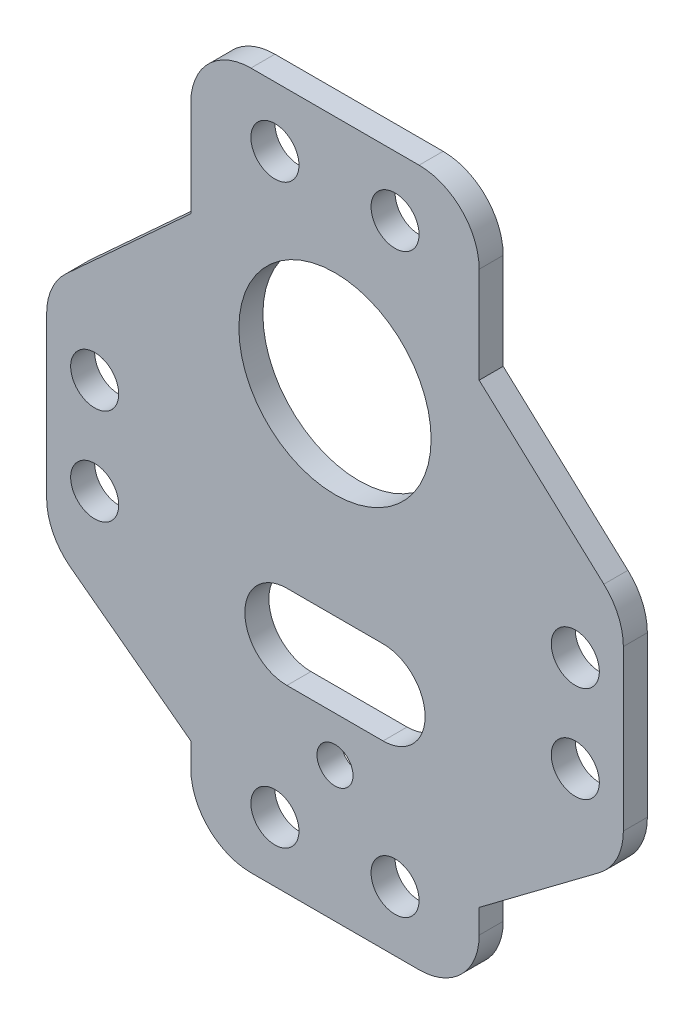
from build123d import *

# Parameters (mm, degrees)
SKETCH_1_R      = 1.5
SKETCH_1_R_2    = 8
SKETCH_1_R_3    = 2
EXTRUDE_1_DEPTH = 2
FILLET_1_R      = 5


with BuildPart() as part:
    # 草图1 → 凸台-拉伸1 (new body)
    with BuildSketch(Plane.XY):
        Polygon((20, -19), (-4, -19), (-4, -32), (-16, -43), (-16, -61), (-4, -70), (-4, -77), (20, -77), (20, -70), (32, -61), (32, -43), (20, -32), align=None)
        with Locations((8, -65.75)):
            Circle(SKETCH_1_R, mode=Mode.SUBTRACT)
        with Locations((8, -38.25)):
            Circle(SKETCH_1_R_2, mode=Mode.SUBTRACT)
        with Locations((3, -72)):
            Circle(SKETCH_1_R_3, mode=Mode.SUBTRACT)
        with Locations((13, -72)):
            Circle(SKETCH_1_R_3, mode=Mode.SUBTRACT)
        with Locations((-12, -48)):
            Circle(SKETCH_1_R_3, mode=Mode.SUBTRACT)
        with Locations((-12, -56)):
            Circle(SKETCH_1_R_3, mode=Mode.SUBTRACT)
        with Locations(Location((28, -56, 0), (0, 0, 180))):
            Circle(SKETCH_1_R_3, mode=Mode.SUBTRACT)
        with Locations(Location((28, -48, 0), (0, 0, 180))):
            Circle(SKETCH_1_R_3, mode=Mode.SUBTRACT)
        with Locations((3, -24)):
            Circle(SKETCH_1_R_3, mode=Mode.SUBTRACT)
        with Locations((13, -24)):
            Circle(SKETCH_1_R_3, mode=Mode.SUBTRACT)
        with BuildLine():
            Line((4, -55), (12, -55))
            ThreePointArc((12, -55), (15.5, -58.5), (12, -62))
            Line((12, -62), (4, -62))
            ThreePointArc((4, -62), (0.5, -58.5), (4, -55))
        make_face(mode=Mode.SUBTRACT)
    extrude(amount=EXTRUDE_1_DEPTH)

    # 圆角1
    fillet_1_edges = [part.edges().sort_by_distance(p)[0] for p in [
        (32, -43, 1),
        (20, -19, 1),
        (-4, -19, 1),
        (-16, -43, 1),
        (-16, -61, 1),
        (-4, -77, 1),
        (20, -77, 1),
        (32, -61, 1),
    ]]
    fillet(fillet_1_edges, radius=FILLET_1_R)


solid = part.part
